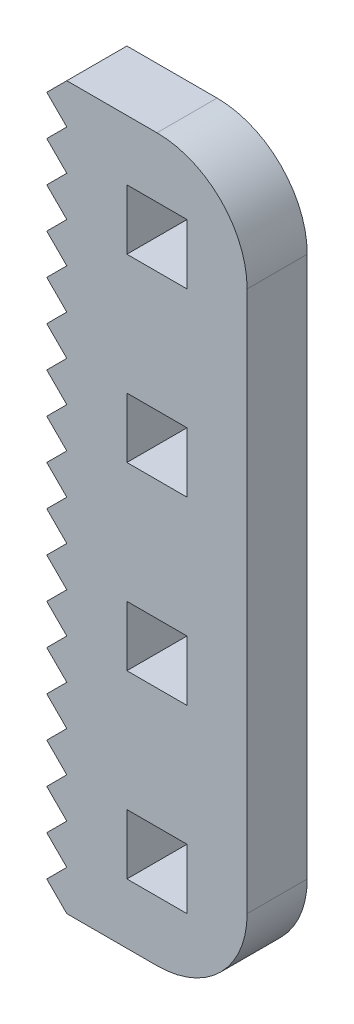
from build123d import *

# Parameters (mm, degrees)
MODEL_W                 = 3
MODEL_H                 = 3
SALIENTE_EXTRUIR1_DEPTH = 3


with BuildPart() as part:
    # Model → Saliente-Extruir1 (new body)
    with BuildSketch(Plane.XY):
        with BuildLine():
            Line((9.925690899, 288.164372243), (8.925690899, 289.164372243))
            Line((8.925690899, 289.164372243), (9.925690899, 290.164372243))
            Line((9.925690899, 290.164372243), (14.425690899, 290.164372243))
            ThreePointArc((14.425690899, 290.164372243), (17.607671414, 288.846352758), (18.925690899, 285.664372243))
            Line((18.925690899, 285.664372243), (18.925690899, 258.664372243))
            ThreePointArc((18.925690899, 258.664372243), (17.607671414, 255.482391728), (14.425690899, 254.164372243))
            Line((14.425690899, 254.164372243), (9.925690899, 254.164372243))
            Line((9.925690899, 254.164372243), (8.925690899, 255.164372243))
            Line((8.925690899, 255.164372243), (9.925690899, 256.164372243))
            Line((9.925690899, 256.164372243), (8.925690899, 257.164372243))
            Line((8.925690899, 257.164372243), (9.925690899, 258.164372243))
            Line((9.925690899, 258.164372243), (8.925690899, 259.164372243))
            Line((8.925690899, 259.164372243), (9.925690899, 260.164372243))
            Line((9.925690899, 260.164372243), (8.925690899, 261.164372243))
            Line((8.925690899, 261.164372243), (9.925690899, 262.164372243))
            Line((9.925690899, 262.164372243), (8.925690899, 263.164372243))
            Line((8.925690899, 263.164372243), (9.925690899, 264.164372243))
            Line((9.925690899, 264.164372243), (8.925690899, 265.164372243))
            Line((8.925690899, 265.164372243), (9.925690899, 266.164372243))
            Line((9.925690899, 266.164372243), (8.925690899, 267.164372243))
            Line((8.925690899, 267.164372243), (9.925690899, 268.164372243))
            Line((9.925690899, 268.164372243), (8.925690899, 269.164372243))
            Line((8.925690899, 269.164372243), (9.925690899, 270.164372243))
            Line((9.925690899, 270.164372243), (8.925690899, 271.164372243))
            Line((8.925690899, 271.164372243), (9.925690899, 272.164372243))
            Line((9.925690899, 272.164372243), (8.925690899, 273.164372243))
            Line((8.925690899, 273.164372243), (9.925690899, 274.164372243))
            Line((9.925690899, 274.164372243), (8.925690899, 275.164372243))
            Line((8.925690899, 275.164372243), (9.925690899, 276.164372243))
            Line((9.925690899, 276.164372243), (8.925690899, 277.164372243))
            Line((8.925690899, 277.164372243), (9.925690899, 278.164372243))
            Line((9.925690899, 278.164372243), (8.925690899, 279.164372243))
            Line((8.925690899, 279.164372243), (9.925690899, 280.164372243))
            Line((9.925690899, 280.164372243), (8.925690899, 281.164372243))
            Line((8.925690899, 281.164372243), (9.925690899, 282.164372243))
            Line((9.925690899, 282.164372243), (8.925690899, 283.164372243))
            Line((8.925690899, 283.164372243), (9.925690899, 284.164372243))
            Line((9.925690899, 284.164372243), (8.925690899, 285.164372243))
            Line((8.925690899, 285.164372243), (9.925690899, 286.164372243))
            Line((9.925690899, 286.164372243), (8.925690899, 287.164372243))
            Line((8.925690899, 287.164372243), (9.925690899, 288.164372243))
        make_face()
        with Locations((14.425690899, 285.664372243)):
            Rectangle(MODEL_W, MODEL_H, mode=Mode.SUBTRACT)
        with Locations((14.425690899, 276.664372243)):
            Rectangle(MODEL_W, MODEL_H, mode=Mode.SUBTRACT)
        with Locations((14.425690899, 258.664372243)):
            Rectangle(MODEL_W, MODEL_H, mode=Mode.SUBTRACT)
        with Locations((14.425690899, 267.664372243)):
            Rectangle(MODEL_W, MODEL_H, mode=Mode.SUBTRACT)
    extrude(amount=SALIENTE_EXTRUIR1_DEPTH)


solid = part.part
